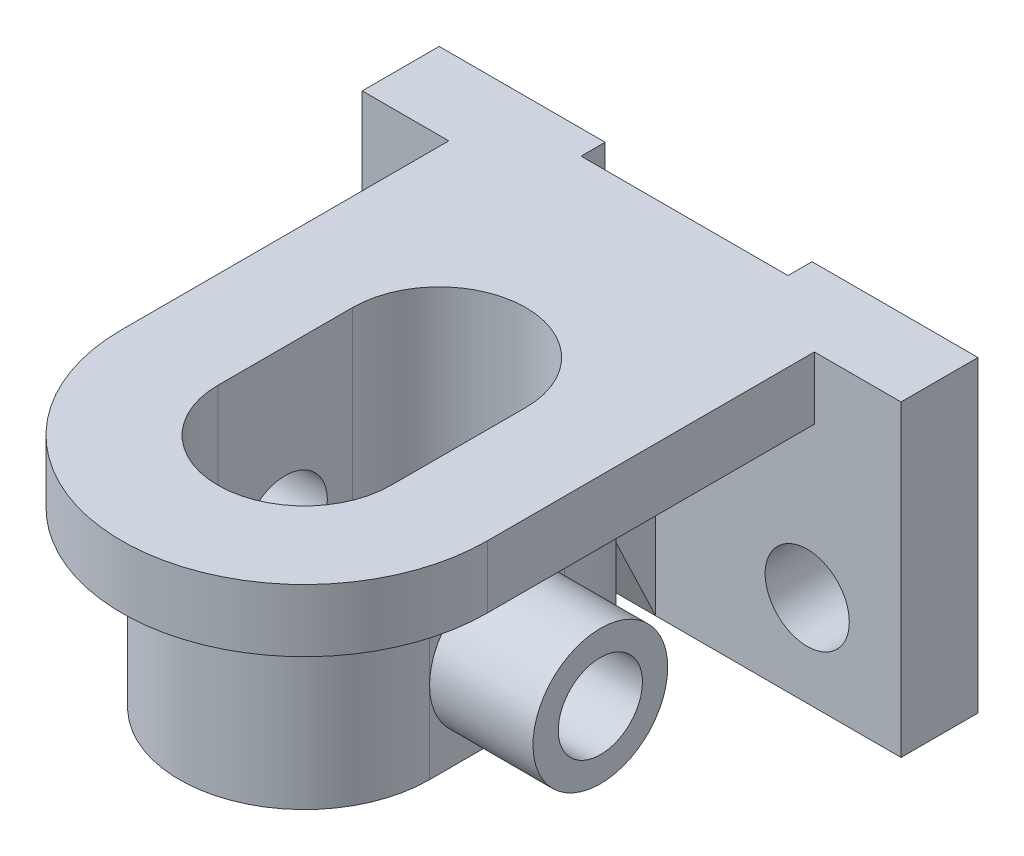
from build123d import *

# Parameters (mm, degrees)
SKETCH_1_W           = 224
SKETCH_1_H           = 128
SKETCH_1_R           = 17.5
EXTRUDE_1_DEPTH      = 32
SKETCH_2_W           = 86
SKETCH_2_H           = 20
CUT_EXTRUDE_1_DEPTH  = 145
EXTRUDE_2_DEPTH      = 26
EXTRUDE_3_DEPTH      = 72
CUT_EXTRUDE_2_DEPTH  = 131
SKETCH_6_R           = 28
EXTRUDE_5_DEPTH      = 43
EXTRUDE_START        = 43
SKETCH_7_R           = 28
EXTRUDE_6_DEPTH      = 43
SKETCH_8_R           = 17.5
CUT_EXTRUDE_3_DEPTH  = 241
EXTRUDE_7_DEPTH      = 10
EXTRUDE_7_DEPTH_BACK = 10


with BuildPart() as part:
    # 草图1 → 凸台-拉伸1 (new body)
    with BuildSketch(Plane.XY):
        Rectangle(SKETCH_1_W, SKETCH_1_H)
        with Locations((73, -26)):
            Circle(SKETCH_1_R, mode=Mode.SUBTRACT)
        with Locations(Location((-73, -26, 0), (0, 0, 180))):
            Circle(SKETCH_1_R, mode=Mode.SUBTRACT)
    extrude(amount=EXTRUDE_1_DEPTH)

    # 草图2 → 切除-拉伸1 (cut)
    with BuildSketch(Plane.XZ.offset(64)):
        Rectangle(SKETCH_2_W, SKETCH_2_H)
    extrude(amount=-CUT_EXTRUDE_1_DEPTH, mode=Mode.SUBTRACT)

    # 草图3 → 凸台-拉伸2 (add)
    with BuildSketch(Plane(origin=(0, 64, 0), x_dir=(1, 0, 0), z_dir=(0, 1, 0))):
        with BuildLine():
            Line((76, -168), (76, -32))
            Line((76, -32), (-76, -32))
            Line((-76, -32), (-76, -168))
            ThreePointArc((-76, -168), (0, -244), (76, -168))
        make_face()
    extrude(amount=-EXTRUDE_2_DEPTH)

    # 草图4 → 凸台-拉伸3 (add)
    with BuildSketch(Plane.XZ.offset(-38)):
        with BuildLine():
            Line((-52, 168), (-52, 112))
            ThreePointArc((-52, 112), (0, 60), (52, 112))
            Line((52, 112), (52, 168))
            ThreePointArc((52, 168), (0, 220), (-52, 168))
        make_face()
    extrude(amount=EXTRUDE_3_DEPTH)

    # 草图5 → 切除-拉伸2 (cut)
    with BuildSketch(Plane.XZ.offset(34)):
        with BuildLine():
            Line((-36, 168), (-36, 112))
            ThreePointArc((-36, 112), (0, 76), (36, 112))
            Line((36, 112), (36, 168))
            ThreePointArc((36, 168), (0, 204), (-36, 168))
        make_face()
    extrude(amount=-CUT_EXTRUDE_2_DEPTH, mode=Mode.SUBTRACT)

    # 草图6 → 凸台-拉伸5 (add)
    with BuildSketch(Plane.ZY.offset(52)):
        with Locations(Location((140, 0, 0), (0, 0, 180))):
            Circle(SKETCH_6_R)
    extrude(amount=EXTRUDE_5_DEPTH)

    # 草图7 → 凸台-拉伸6 (add)
    with BuildSketch(Plane(origin=(52, 0, 0), x_dir=(0, 0, -1), z_dir=(1, 0, 0)).offset(EXTRUDE_START)):
        with Locations((-140, 0)):
            Circle(SKETCH_7_R)
    extrude(amount=-EXTRUDE_6_DEPTH)

    # 草图8 → 切除-拉伸3 (cut)
    with BuildSketch(Plane.ZY.offset(95)):
        with Locations(Location((140, 0, 0), (0, 0, 90))):
            Circle(SKETCH_8_R)
    extrude(amount=-CUT_EXTRUDE_3_DEPTH, mode=Mode.SUBTRACT)

    # 草图9 → 凸台-拉伸7 (add, two sides: drawn at the far end of the back side and taken through both)
    with BuildSketch(Plane(origin=(0, 0, 0), x_dir=(0, 0, -1), z_dir=(1, 0, 0)).offset(-EXTRUDE_7_DEPTH_BACK)):
        Polygon((-52, -22), (-67.637033122, -22), (-67.637033122, 38), (-32, 38), (-32, -64), align=None)
    extrude(amount=EXTRUDE_7_DEPTH + EXTRUDE_7_DEPTH_BACK)


solid = part.part
